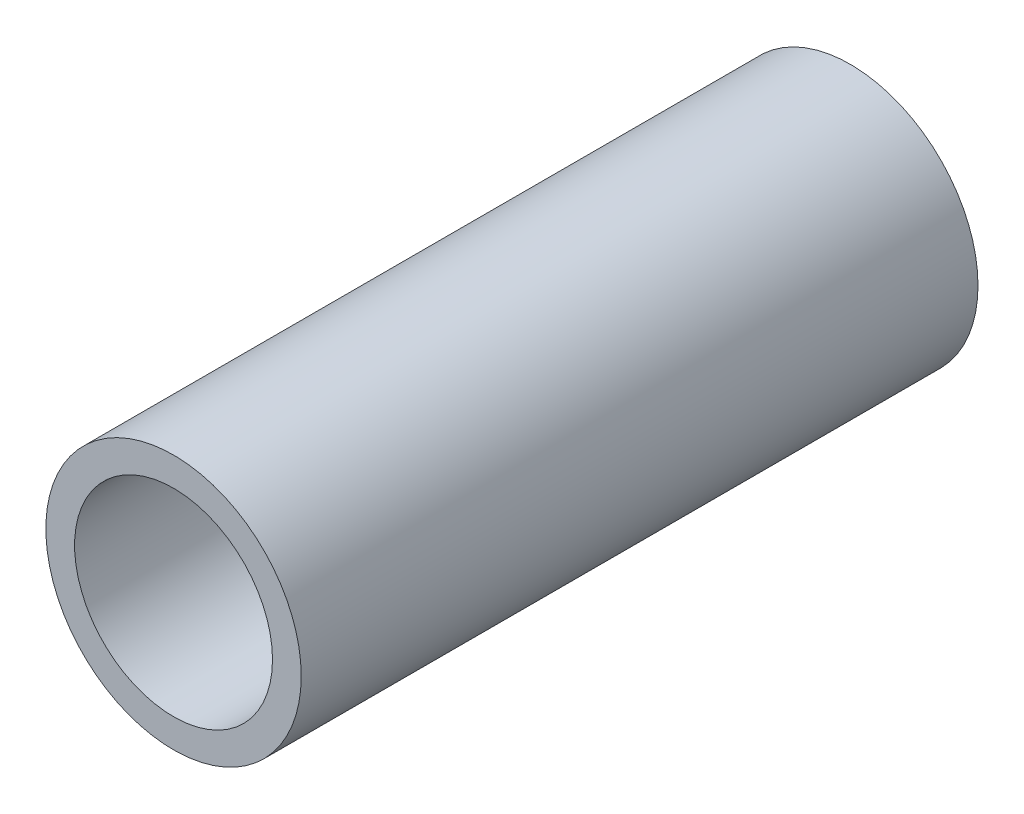
from build123d import *

# Parameters (mm, degrees)
SKETCH_1_R      = 1
SKETCH_1_R_2    = 0.775
EXTRUDE_1_DEPTH = 5.3


with BuildPart() as part:
    # Эскиз1 → Бобышка-Вытянуть1 (new body)
    with BuildSketch(Plane.XY):
        Circle(SKETCH_1_R)
        Circle(SKETCH_1_R_2, mode=Mode.SUBTRACT)
    extrude(amount=EXTRUDE_1_DEPTH)


solid = part.part
